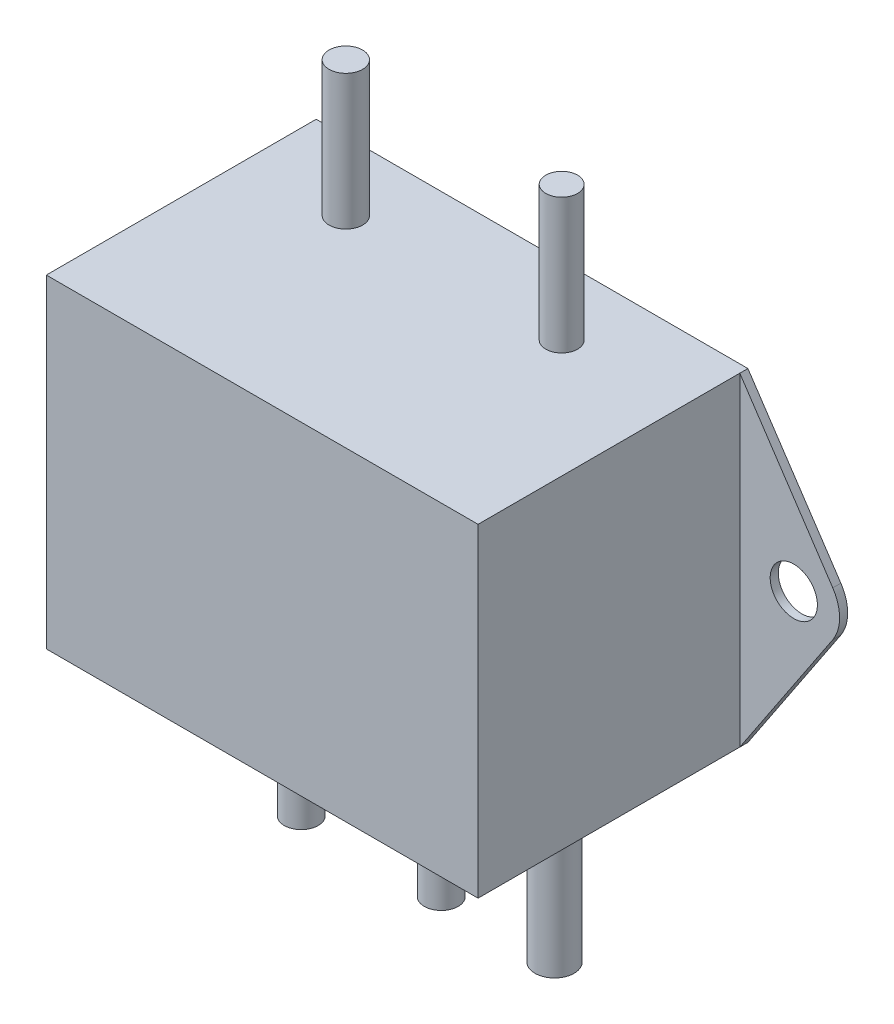
from build123d import *

# Parameters (mm, degrees)
SKETCH_1_W          = 32
SKETCH_1_H          = 24
EXTRUDE_1_DEPTH     = 20
EXTRUDE_2_DEPTH     = 0.6
SKETCH_3_R          = 1.75
CUT_EXTRUDE_1_DEPTH = 34.111327367
FILLET_1_R          = 3
SKETCH_4_R          = 1.241957667
SKETCH_4_R_2        = 1.176925768
EXTRUDE_3_DEPTH     = 10
SKETCH_5_R          = 1.255951998
SKETCH_5_R_2        = 1.449746198
EXTRUDE_4_DEPTH     = 15


with BuildPart() as part:
    # 草图1 → 凸台-拉伸1 (new body)
    with BuildSketch(Plane.XY):
        Rectangle(SKETCH_1_W, SKETCH_1_H)
    extrude(amount=EXTRUDE_1_DEPTH)

    # 草图2 → 凸台-拉伸2 (add)
    with BuildSketch(Plane.XY):
        Polygon((-16, 12), (-24, 0), (-16, -12), align=None)
        Polygon((16, -12), (16, 12), (24, 0), align=None)
    extrude(amount=EXTRUDE_2_DEPTH)

    # 草图3 → 切除-拉伸1 (cut, through all)
    with BuildSketch(Plane.XY.offset(0.6)):
        with Locations((-20, 0)):
            Circle(SKETCH_3_R)
        with Locations((20, 0)):
            Circle(SKETCH_3_R)
    extrude(amount=-CUT_EXTRUDE_1_DEPTH, mode=Mode.SUBTRACT)

    # 圆角1
    fillet_1_edges = [part.edges().sort_by_distance(p)[0] for p in [
        (24, 0, 0.3),
        (-24, 0, 0.3),
    ]]
    fillet(fillet_1_edges, radius=FILLET_1_R)

    # 草图4 → 凸台-拉伸3 (add)
    with BuildSketch(Plane(origin=(0, 12, 0), x_dir=(1, 0, 0), z_dir=(0, 1, 0))):
        with Locations(Location((-8.72556125, -5.075346112, 0), (0, 0, 90))):
            Circle(SKETCH_4_R)
        with Locations(Location((7.271301042, -5.075346112, 0), (0, 0, 90))):
            Circle(SKETCH_4_R_2)
    extrude(amount=EXTRUDE_3_DEPTH)

    # 草图5 → 凸台-拉伸4 (add)
    with BuildSketch(Plane.XZ.offset(12)):
        with Locations(Location((-10.840848826, 6.265195374, 0), (0, 0, 90))):
            Circle(SKETCH_5_R)
        with Locations(Location((-0.462719157, 6.265195374, 0), (0, 0, 90))):
            Circle(SKETCH_5_R)
        with Locations(Location((7.932328409, 6.265195374, 0), (0, 0, 90))):
            Circle(SKETCH_5_R_2)
    extrude(amount=EXTRUDE_4_DEPTH)


solid = part.part
